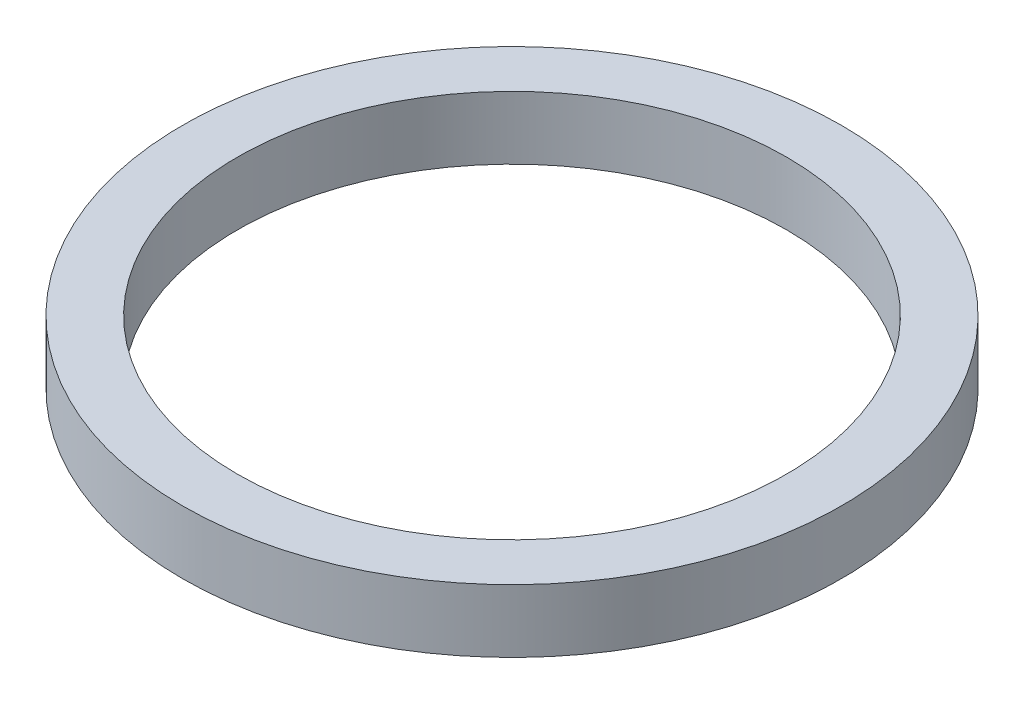
from build123d import *

# Parameters (mm, degrees)
SKETCH1_R           = 15
SKETCH1_R_2         = 12.5
BOSS_EXTRUDE1_DEPTH = 2.87


with BuildPart() as part:
    # Sketch1 → Boss-Extrude1 (new body)
    with BuildSketch(Plane(origin=(0, 0, 0), x_dir=(1, 0, 0), z_dir=(0, 1, 0))):
        with Locations(Location((0, 0, 0), (0, 0, 270))):
            Circle(SKETCH1_R)
        with Locations(Location((0, 0, 0), (0, 0, 270))):
            Circle(SKETCH1_R_2, mode=Mode.SUBTRACT)
    extrude(amount=BOSS_EXTRUDE1_DEPTH)


solid = part.part
